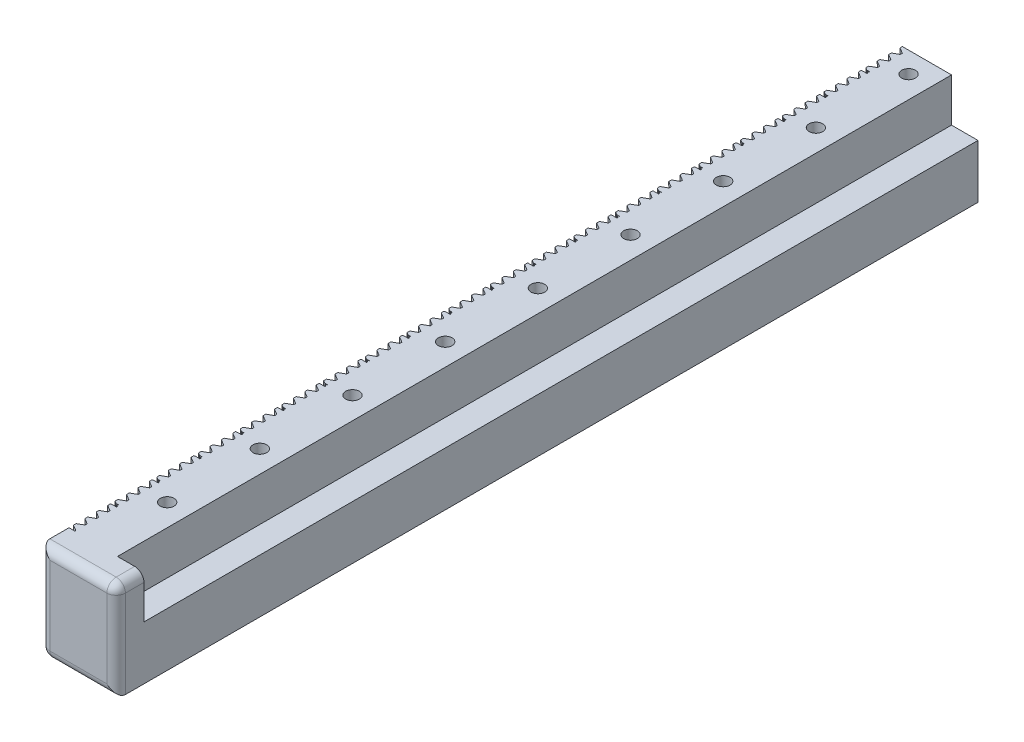
from build123d import *

# Parameters (mm, degrees)
BOSS_EXTRUDE1_DEPTH = 90
SKETCH2_W           = 8.155
SKETCH2_H           = 10.481876136
BOSS_EXTRUDE2_DEPTH = 3
FILLET1_R           = 1
CUT_EXTRUDE2_DEPTH  = 13
LPATTERN1_COUNT     = 20
LPATTERN1_PITCH     = 4.5
SKETCH4_R           = 0.738163421
CUT_EXTRUDE3_DEPTH  = 18


with BuildPart() as part:
    # Sketch1 → Boss-Extrude1 (new body)
    with BuildSketch(Plane.XY):
        Polygon((8.155, 3.559455538), (8.155, -2.228876136), (6.255, -2.228876136), (6.255, 0), (0.288201111, 0), (0, 8.253), (5.3, 8.253), (5.3, 3.559455538), align=None)
    extrude(amount=BOSS_EXTRUDE1_DEPTH)

    # Sketch2 → Boss-Extrude2 (add)
    with BuildSketch(Plane.XY.offset(90)):
        with Locations((4.0775, 3.012061932)):
            Rectangle(SKETCH2_W, SKETCH2_H)
    extrude(amount=BOSS_EXTRUDE2_DEPTH)

    # Fillet1
    fillet1_edges = [part.edges().sort_by_distance(p)[0] for p in [
        (4.0775, 8.253, 93),
        (8.155, 3.012061932, 93),
        (4.0775, -2.228876136, 93),
        (0, 3.012061932, 93),
        (0, -2.228876136, 91.5),
        (8.155, 8.253, 91.5),
    ]]
    fillet(fillet1_edges, radius=FILLET1_R)

    # Sketch3 → Cut-Extrude2 (cut)
    with BuildSketch(Plane(origin=(5.3, 0, 0), x_dir=(0, 0, -1), z_dir=(0, 1, 0))):
        Polygon((-87.581204138, 4.677434927), (-88.071492687, 5.550739132), (-88.589803642, 4.677434927), (-88.811204138, 4.677434927), (-89.301492687, 5.550739132), (-89.819803642, 4.677434927), (-89.932372195, 4.677434927), (-89.932372195, 6.922091214), (-85.121204138, 6.922091214), (-85.121204138, 4.677434927), (-85.611492687, 5.550739132), (-86.129803642, 4.677434927), (-86.351204138, 4.677434927), (-86.841492687, 5.550739132), (-87.359803642, 4.677434927), align=None)
    cut_extrude2 = extrude(amount=CUT_EXTRUDE2_DEPTH, mode=Mode.SUBTRACT)

    # LPattern1: Cut-Extrude2 ×20
    with Locations(*[(0, 0, -i * LPATTERN1_PITCH) for i in range(1, LPATTERN1_COUNT)]):
        add(cut_extrude2, mode=Mode.SUBTRACT)

    # Sketch4 → Cut-Extrude3 (cut)
    with BuildSketch(Plane(origin=(0, 8.253, 0), x_dir=(1, 0, 0), z_dir=(0, 1, 0))):
        with Locations(Location((2.914813358, -2.25139735, 0), (0, 0, 270))):
            Circle(SKETCH4_R)
        with Locations(Location((2.914813358, -12.25139735, 0), (0, 0, 270))):
            Circle(SKETCH4_R)
        with Locations(Location((2.914813358, -22.25139735, 0), (0, 0, 270))):
            Circle(SKETCH4_R)
        with Locations(Location((2.914813358, -32.25139735, 0), (0, 0, 270))):
            Circle(SKETCH4_R)
        with Locations(Location((2.914813358, -42.25139735, 0), (0, 0, 270))):
            Circle(SKETCH4_R)
        with Locations(Location((2.914813358, -52.25139735, 0), (0, 0, 270))):
            Circle(SKETCH4_R)
        with Locations(Location((2.914813358, -62.25139735, 0), (0, 0, 270))):
            Circle(SKETCH4_R)
        with Locations(Location((2.914813358, -72.25139735, 0), (0, 0, 270))):
            Circle(SKETCH4_R)
        with Locations(Location((2.914813358, -82.25139735, 0), (0, 0, 270))):
            Circle(SKETCH4_R)
    extrude(amount=-CUT_EXTRUDE3_DEPTH, mode=Mode.SUBTRACT)


solid = part.part
